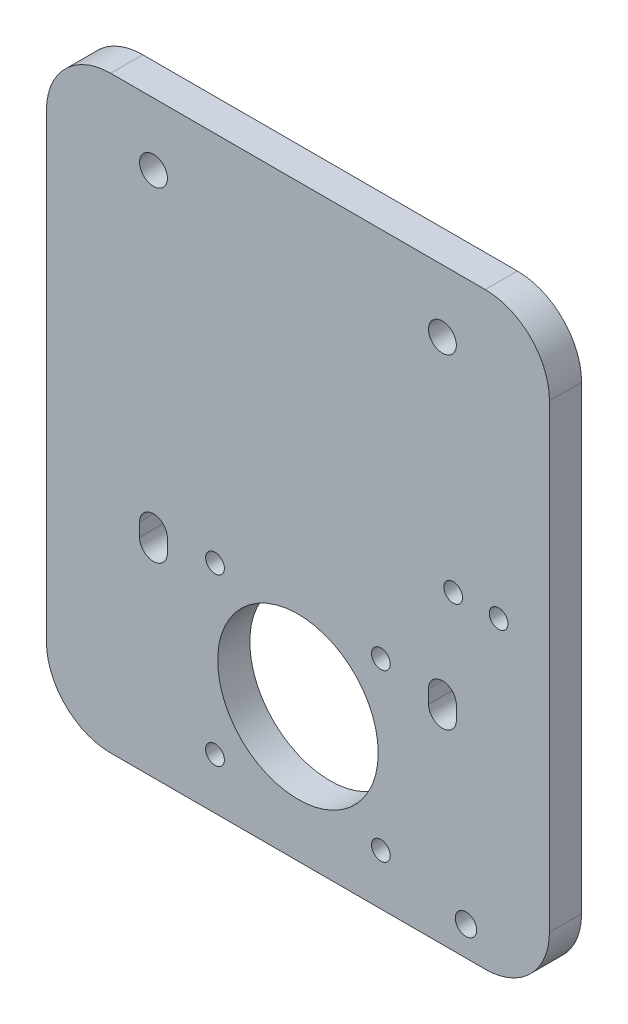
from build123d import *

# Parameters (mm, degrees)
MODEL_R            = 1.75
MODEL_R_2          = 15
MODEL_R_3          = 2.6
BASE_DEPTH         = 6
SKETCH1_R          = 1.75
CABLEMOUNT_DEPTH   = 10
SKETCH2_R          = 2
CUT_EXTRUDE1_DEPTH = 120.770614092


with BuildPart() as part:
    # Model → Base (new body)
    with BuildSketch(Plane.XY):
        with BuildLine():
            Line((47, 98), (47, 12))
            ThreePointArc((47, 12), (43.485281374, 3.514718626), (35, 0))
            Line((35, 0), (-35, 0))
            ThreePointArc((-35, 0), (-43.485281374, 3.514718626), (-47, 12))
            Line((-47, 12), (-47, 98))
            ThreePointArc((-47, 98), (-43.485281374, 106.485281374), (-35, 110))
            Line((-35, 110), (35, 110))
            ThreePointArc((35, 110), (43.485281374, 106.485281374), (47, 98))
        make_face()
        with Locations((15.5, 9.5)):
            Circle(MODEL_R, mode=Mode.SUBTRACT)
        with Locations((15.5, 40.5)):
            Circle(MODEL_R, mode=Mode.SUBTRACT)
        with Locations((-15.5, 40.5)):
            Circle(MODEL_R, mode=Mode.SUBTRACT)
        with Locations((-15.5, 9.5)):
            Circle(MODEL_R, mode=Mode.SUBTRACT)
        with Locations((0, 25)):
            Circle(MODEL_R_2, mode=Mode.SUBTRACT)
        with Locations((27, 98.3)):
            Circle(MODEL_R_3, mode=Mode.SUBTRACT)
        with Locations((-27, 98.3)):
            Circle(MODEL_R_3, mode=Mode.SUBTRACT)
        with BuildLine():
            Line((-24.4, 40.1), (-24.4, 37.6))
            ThreePointArc((-24.4, 37.6), (-27, 35), (-29.6, 37.6))
            Line((-29.6, 37.6), (-29.6, 40.1))
            ThreePointArc((-29.6, 40.1), (-27, 42.7), (-24.4, 40.1))
        make_face(mode=Mode.SUBTRACT)
        with BuildLine():
            Line((24.4, 40.1), (24.4, 37.6))
            ThreePointArc((24.4, 37.6), (27, 35), (29.6, 37.6))
            Line((29.6, 37.6), (29.6, 40.1))
            ThreePointArc((29.6, 40.1), (27, 42.7), (24.4, 40.1))
        make_face(mode=Mode.SUBTRACT)
    extrude(amount=BASE_DEPTH)

    # Sketch1 → CableMount (cut)
    with BuildSketch(Plane(origin=(0, 0, 0), x_dir=(-1, 0, 0), z_dir=(0, 0, -1))):
        with Locations((-29, 58)):
            Circle(SKETCH1_R)
        with Locations((-37.5, 58)):
            Circle(SKETCH1_R)
    extrude(amount=-CABLEMOUNT_DEPTH, mode=Mode.SUBTRACT)

    # Sketch2 → Cut-Extrude1 (cut, through all)
    with BuildSketch(Plane.XY.offset(6)):
        with Locations((31.394827987, 5.505711601)):
            Circle(SKETCH2_R)
    extrude(amount=-CUT_EXTRUDE1_DEPTH, mode=Mode.SUBTRACT)


solid = part.part
